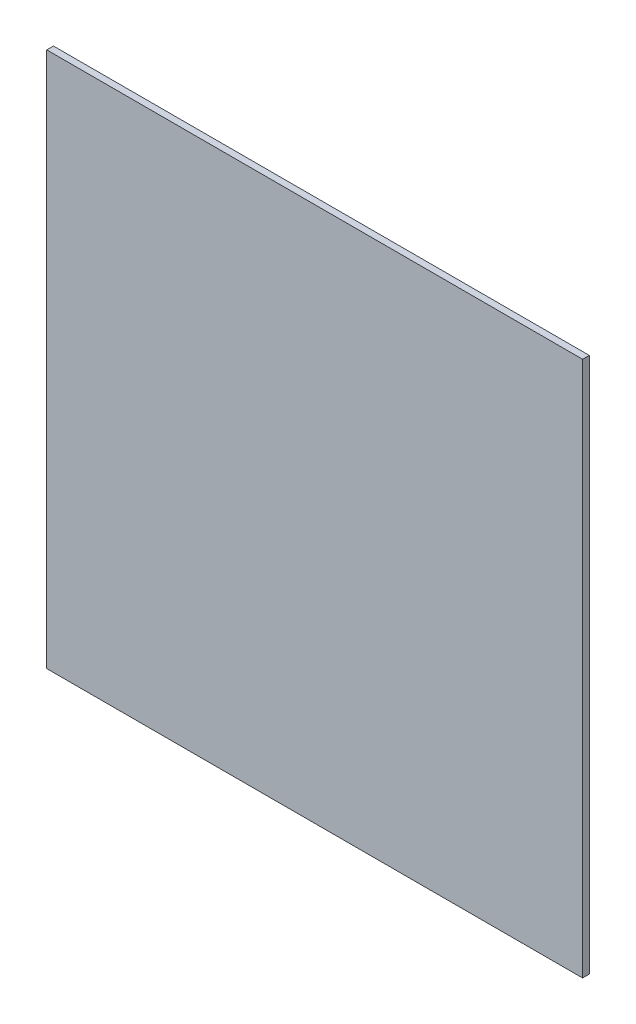
from build123d import *

# Parameters (mm, degrees)
SKETCH1_W           = 127
SKETCH1_H           = 127
BOSS_EXTRUDE1_DEPTH = 1.5875


with BuildPart() as part:
    # Sketch1 → Boss-Extrude1 (new body)
    with BuildSketch(Plane.XY):
        with Locations((7.123281263, -28.826606557)):
            Rectangle(SKETCH1_W, SKETCH1_H)
    extrude(amount=BOSS_EXTRUDE1_DEPTH)


solid = part.part
